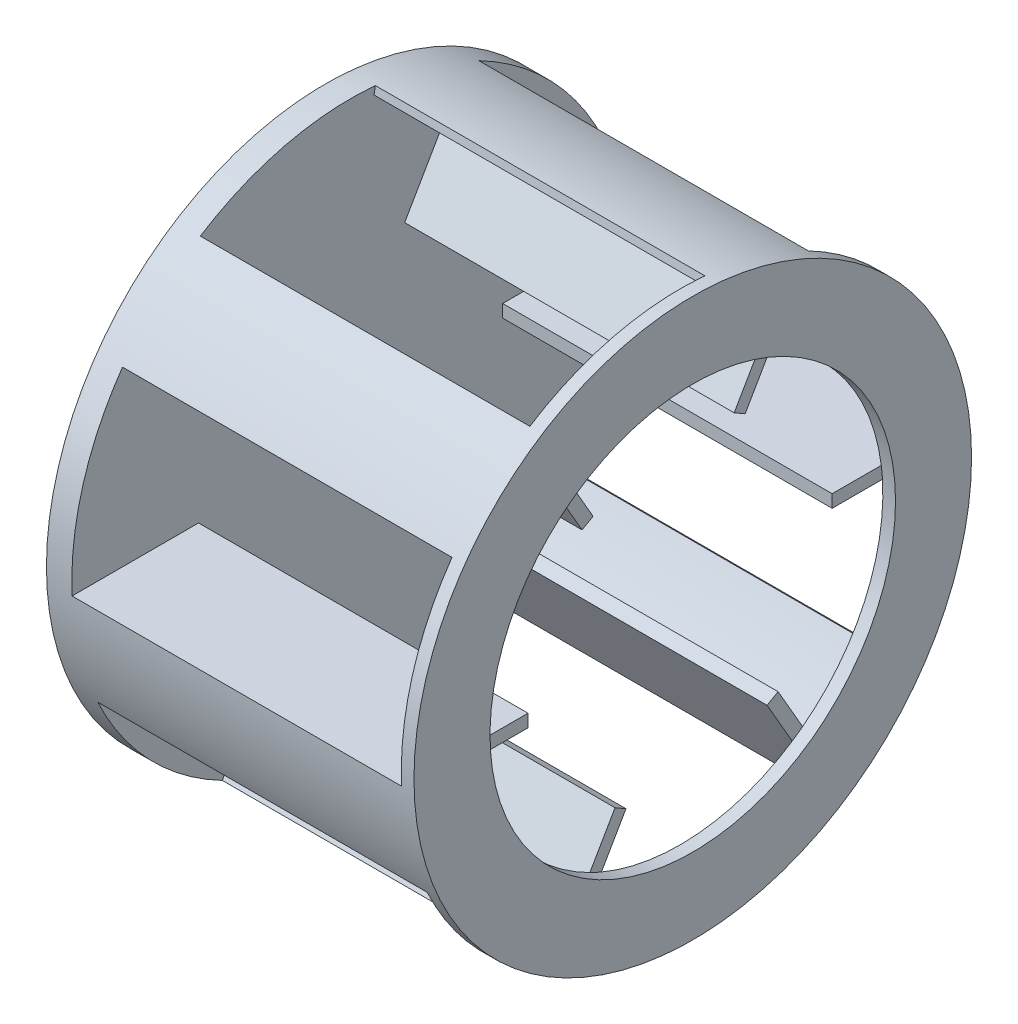
from build123d import *

# Parameters (mm, degrees)
SKETCH3_R           = 38.1
SKETCH3_R_2         = 19.05
BOSS_EXTRUDE1_DEPTH = 76.2
SKETCH3_3_R         = 139.7
SKETCH3_3_R_2       = 38.1
BOSS_EXTRUDE2_DEPTH = 12.7
BOSS_EXTRUDE5_START = 165.1
BOSS_EXTRUDE5_DEPTH = 165.1
CIRPATTERN1_COUNT   = 6
BOSS_EXTRUDE6_START = 6.35
SKETCH5_R           = 139.7
SKETCH5_R_2         = 101.6
BOSS_EXTRUDE6_DEPTH = 6.35


with BuildPart() as part:
    # Sketch3 → Boss-Extrude1 (new body)
    with BuildSketch(Plane(origin=(0, 0, 0), x_dir=(0, 0, -1), z_dir=(1, 0, 0))):
        Circle(SKETCH3_R)
        Circle(SKETCH3_R_2, mode=Mode.SUBTRACT)
    extrude(amount=-BOSS_EXTRUDE1_DEPTH)

    # Sketch3<3> → Boss-Extrude2 (add)
    with BuildSketch(Plane(origin=(0, 0, 0), x_dir=(0, 0, -1), z_dir=(1, 0, 0))):
        Circle(SKETCH3_3_R)
        Circle(SKETCH3_3_R_2, mode=Mode.SUBTRACT)
    extrude(amount=-BOSS_EXTRUDE2_DEPTH)

    # Sketch4<4> → Boss-Extrude5 (add)
    with BuildSketch(Plane(origin=(0, 0, 0), x_dir=(0, 0, -1), z_dir=(1, 0, 0)).offset(BOSS_EXTRUDE5_START)):
        with BuildLine():
            Line((-49.098522628, 59.641135768), (-43.599261314, 62.816135768))
            Line((-43.599261314, 62.816135768), (-75.277064912, 117.683701073))
            ThreePointArc((-75.277064912, 117.683701073), (-96.609488412, 100.909349165), (-114.296295848, 80.32712341))
            Line((-114.296295848, 80.32712341), (-111.366656278, 77.868863928))
            ThreePointArc((-111.366656278, 77.868863928), (-96.424300498, 95.752004541), (-78.646142874, 110.819115278))
            Line((-78.646142874, 110.819115278), (-49.098522628, 59.641135768))
        make_face()
    boss_extrude5 = extrude(amount=-BOSS_EXTRUDE5_DEPTH)

    # CirPattern1: Boss-Extrude5 ×6 about axis
    cirpattern1_axis = Axis((0, 0, 0), (1, 0, 0))
    for i in range(1, CIRPATTERN1_COUNT):
        add(boss_extrude5.rotate(cirpattern1_axis, i * 360 / CIRPATTERN1_COUNT))

    # Sketch5 → Boss-Extrude6 (add)
    with BuildSketch(Plane(origin=(165.1, 0, 0), x_dir=(0, 0, -1), z_dir=(1, 0, 0)).offset(BOSS_EXTRUDE6_START)):
        Circle(SKETCH5_R)
        Circle(SKETCH5_R_2, mode=Mode.SUBTRACT)
    extrude(amount=-BOSS_EXTRUDE6_DEPTH)


solid = part.part
